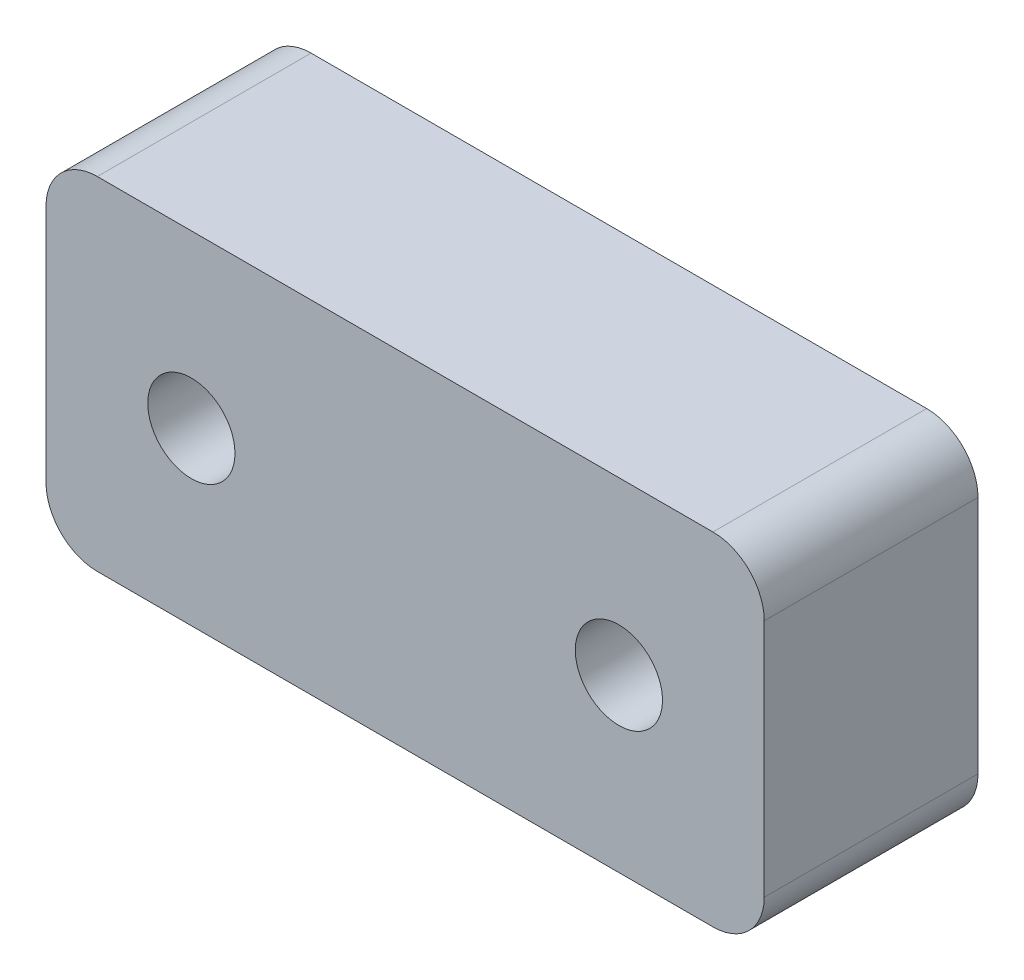
from build123d import *

# Parameters (mm, degrees)
SKETCH_1_W          = 42
SKETCH_1_H          = 20
EXTRUDE_1_DEPTH     = 12.5
SKETCH_2_R          = 2.55
CUT_EXTRUDE_1_DEPTH = 27.405491853
FILLET_1_R          = 3


with BuildPart() as part:
    # 草图1 → 凸台-拉伸1 (new body)
    with BuildSketch(Plane.XY):
        Rectangle(SKETCH_1_W, SKETCH_1_H)
    extrude(amount=EXTRUDE_1_DEPTH)

    # 草图2 → 切除-拉伸1 (cut, through all)
    with BuildSketch(Plane.XY.offset(12.5)):
        with Locations((-12.5, 0)):
            Circle(SKETCH_2_R)
        with Locations(Location((12.5, 0, 0), (0, 0, 180))):
            Circle(SKETCH_2_R)
    extrude(amount=-CUT_EXTRUDE_1_DEPTH, mode=Mode.SUBTRACT)

    # 圆角1
    fillet_1_edges = [part.edges().sort_by_distance(p)[0] for p in [
        (-21, 10, 6.25),
        (21, 10, 6.25),
        (21, -10, 6.25),
        (-21, -10, 6.25),
    ]]
    fillet(fillet_1_edges, radius=FILLET_1_R)


solid = part.part
